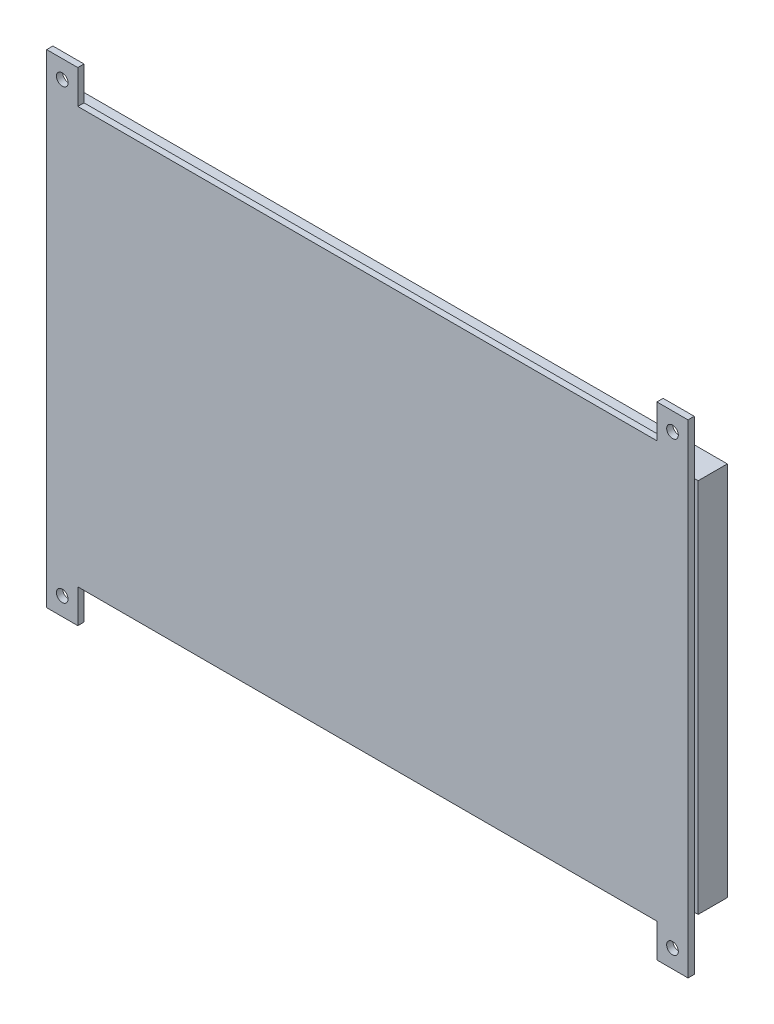
from build123d import *

# Parameters (mm, degrees)
SKETCH1_R           = 1.5
BOSS_EXTRUDE1_DEPTH = 1.6
SKETCH2_W           = 166.9
SKETCH2_H           = 96.573841314
SKETCH2_W_2         = 156.9
SKETCH2_H_2         = 86.573841314
BOSS_EXTRUDE2_DEPTH = 7.5
SKETCH3_W           = 156.9
SKETCH3_H           = 86.573841314
BOSS_EXTRUDE3_DEPTH = 4


with BuildPart() as part:
    # Sketch1 → Boss-Extrude1 (new body)
    with BuildSketch(Plane.XY):
        Polygon((-74.45, -53.48), (74.45, -53.48), (74.45, -62.135), (82.45, -62.135), (82.45, -53.48), (82.45, 53.48), (82.45, 62.135), (74.45, 62.135), (74.45, 53.48), (-74.45, 53.48), (-74.45, 62.135), (-82.45, 62.135), (-82.45, 53.48), (-82.45, -53.48), (-82.45, -62.135), (-74.45, -62.135), align=None)
        with Locations((78.45, 57.48)):
            Circle(SKETCH1_R, mode=Mode.SUBTRACT)
        with Locations((-78.45, 57.48)):
            Circle(SKETCH1_R, mode=Mode.SUBTRACT)
        with Locations(Location((-78.45, -57.48, 0), (0, 0, 180))):
            Circle(SKETCH1_R, mode=Mode.SUBTRACT)
        with Locations(Location((78.45, -57.48, 0), (0, 0, 180))):
            Circle(SKETCH1_R, mode=Mode.SUBTRACT)
    extrude(amount=BOSS_EXTRUDE1_DEPTH)

    # Sketch2 → Boss-Extrude2 (add)
    with BuildSketch(Plane(origin=(0, 0, 0), x_dir=(-1, 0, 0), z_dir=(0, 0, -1))):
        Rectangle(SKETCH2_W, SKETCH2_H)
        Rectangle(SKETCH2_W_2, SKETCH2_H_2, mode=Mode.SUBTRACT)
    extrude(amount=BOSS_EXTRUDE2_DEPTH)

    # Sketch3 → Boss-Extrude3 (add)
    with BuildSketch(Plane(origin=(0, 0, 0), x_dir=(-1, 0, 0), z_dir=(0, 0, -1))):
        Rectangle(SKETCH3_W, SKETCH3_H)
    extrude(amount=BOSS_EXTRUDE3_DEPTH)


solid = part.part
